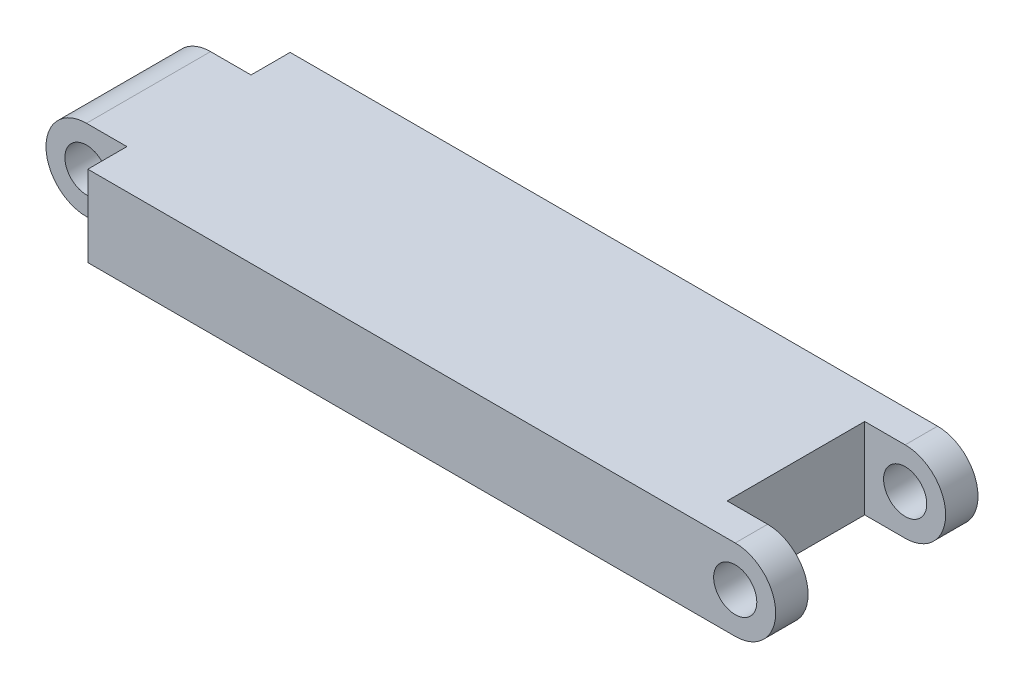
from build123d import *

# Parameters (mm, degrees)
SKETCH_1_W           = 57
SKETCH_1_H           = 15
EXTRUDE_5_DEPTH      = 6
SKETCH_13_W          = 6
SKETCH_13_H          = 10.2
CUT_EXTRUDE_8_DEPTH  = 6
SKETCH_14_R          = 1.6
CUT_EXTRUDE_9_DEPTH  = 17
SKETCH_15_W          = 6
SKETCH_15_H          = 2.4
CUT_EXTRUDE_10_DEPTH = 17
SKETCH_16_R          = 1.6
CUT_EXTRUDE_11_DEPTH = 17
SKETCH_17_W          = 6
SKETCH_17_H          = 6
CUT_EXTRUDE_12_DEPTH = 0.5
SKETCH_18_W          = 6
SKETCH_18_H          = 6
CUT_EXTRUDE_13_DEPTH = 0.5


with BuildPart() as part:
    # 草图1 → 凸台-拉伸5 (new body)
    with BuildSketch(Plane(origin=(0, 0, 0), x_dir=(1, 0, 0), z_dir=(0, 1, 0))):
        with Locations((5.252559727, 3.394197952)):
            Rectangle(SKETCH_1_W, SKETCH_1_H)
    extrude(amount=EXTRUDE_5_DEPTH)

    # 草图13 → 切除-拉伸8 (cut)
    with BuildSketch(Plane(origin=(0, 6, 0), x_dir=(1, 0, 0), z_dir=(0, 1, 0))):
        with Locations((30.752559727, 3.394197952)):
            Rectangle(SKETCH_13_W, SKETCH_13_H)
    extrude(amount=-CUT_EXTRUDE_8_DEPTH, mode=Mode.SUBTRACT)

    # 草图14 → 切除-拉伸9 (cut)
    with BuildSketch(Plane.XY.offset(4.105802048)):
        with Locations((30.752559727, 3)):
            Circle(SKETCH_14_R)
        with BuildLine():
            Line((33.752559727, 6), (30.752559727, 6))
            ThreePointArc((30.752559727, 6), (32.873880071, 5.121320344), (33.752559727, 3))
            Line((33.752559727, 3), (33.752559727, 6))
        make_face()
        with BuildLine():
            Line((33.752559727, 0), (33.752559727, 3))
            ThreePointArc((33.752559727, 3), (32.873880071, 0.878679656), (30.752559727, 0))
            Line((30.752559727, 0), (33.752559727, 0))
        make_face()
    extrude(amount=-CUT_EXTRUDE_9_DEPTH, mode=Mode.SUBTRACT)

    # 草图15 → 切除-拉伸10 (cut)
    with BuildSketch(Plane(origin=(0, 6, 0), x_dir=(1, 0, 0), z_dir=(0, 1, 0))):
        with Locations((-20.247440273, 9.694197952)):
            Rectangle(SKETCH_15_W, SKETCH_15_H)
        with Locations((-20.247440273, -2.905802048)):
            Rectangle(SKETCH_15_W, SKETCH_15_H)
    extrude(amount=-CUT_EXTRUDE_10_DEPTH, mode=Mode.SUBTRACT)

    # 草图16 → 切除-拉伸11 (cut)
    with BuildSketch(Plane.XY.offset(1.705802048)):
        with Locations((-20.247440273, 3)):
            Circle(SKETCH_16_R)
        with BuildLine():
            ThreePointArc((-23.247440273, 3), (-22.368760617, 5.121320344), (-20.247440273, 6))
            Line((-20.247440273, 6), (-23.247440273, 6))
            Line((-23.247440273, 6), (-23.247440273, 3))
        make_face()
        with BuildLine():
            ThreePointArc((-20.247440273, 0), (-22.368760617, 0.878679656), (-23.247440273, 3))
            Line((-23.247440273, 3), (-23.247440273, 0))
            Line((-23.247440273, 0), (-20.247440273, 0))
        make_face()
    extrude(amount=-CUT_EXTRUDE_11_DEPTH, mode=Mode.SUBTRACT)

    # 草图17 → 切除-拉伸12 (cut)
    with BuildSketch(Plane(origin=(0, 0, -8.494197952), x_dir=(-1, 0, 0), z_dir=(0, 0, -1))):
        with Locations((20.247440273, 3)):
            Rectangle(SKETCH_17_W, SKETCH_17_H)
    extrude(amount=-CUT_EXTRUDE_12_DEPTH, mode=Mode.SUBTRACT)

    # 草图18 → 切除-拉伸13 (cut)
    with BuildSketch(Plane.XY.offset(1.705802048)):
        with Locations((-20.247440273, 3)):
            Rectangle(SKETCH_18_W, SKETCH_18_H)
    extrude(amount=-CUT_EXTRUDE_13_DEPTH, mode=Mode.SUBTRACT)


solid = part.part
